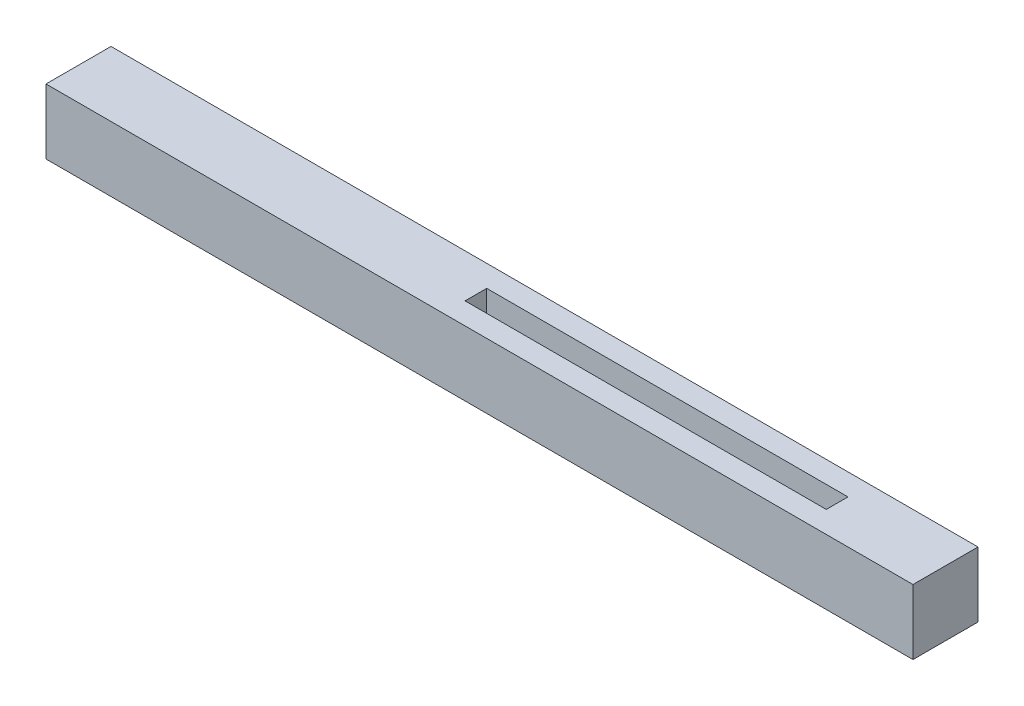
from build123d import *

# Parameters (mm, degrees)
SKETCH_1_W      = 120
SKETCH_1_H      = 9
SKETCH_1_W_2    = 50
SKETCH_1_H_2    = 3
EXTRUDE_1_DEPTH = 9


with BuildPart() as part:
    # 草图1 → 凸台-拉伸1 (new body)
    with BuildSketch(Plane(origin=(0, 0, 0), x_dir=(1, 0, 0), z_dir=(0, 1, 0))):
        with Locations((-0.240940886, 13.862649583)):
            Rectangle(SKETCH_1_W, SKETCH_1_H)
        with Locations((19.759059114, 13.862649583)):
            Rectangle(SKETCH_1_W_2, SKETCH_1_H_2, mode=Mode.SUBTRACT)
    extrude(amount=EXTRUDE_1_DEPTH)


solid = part.part
